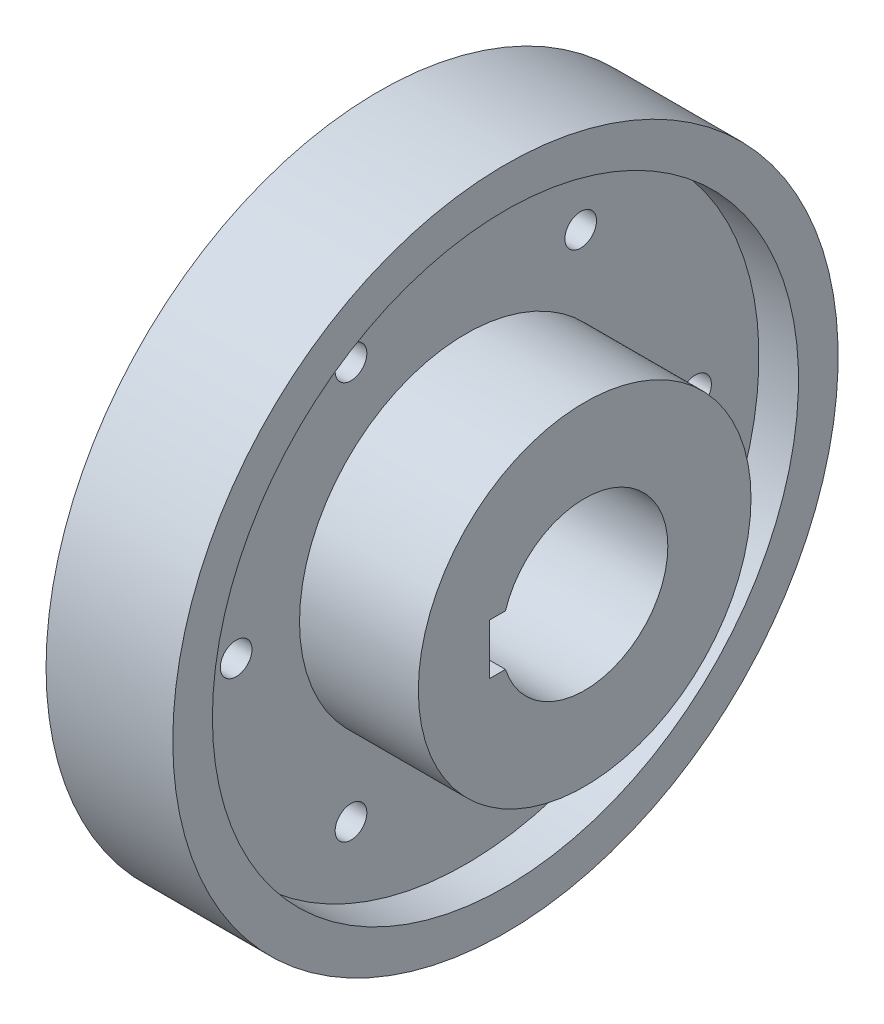
from build123d import *

# Parameters (mm, degrees)
SKETCH3_R               = 10
CUT_EXTRUDE1_DEPTH      = 307.30866785
CIRPATTERN1_COUNT       = 6
CUT_EXTRUDE2_DEPTH      = 325.191301549
CUT_EXTRUDE2_DEPTH_BACK = 325.191301549
SKETCH4_W               = 32
SKETCH4_H               = 10
CUT_EXTRUDE3_DEPTH      = 325.191301549
CUT_EXTRUDE3_DEPTH_BACK = 10
SKETCH5_R               = 100


with BuildPart() as part:
    # Sketch2 → Revolve1 (revolve)
    with BuildSketch(Plane(origin=(0, 0, 0), x_dir=(-1, 0, 0), z_dir=(0, 1, 0))):
        Polygon((-138.434782609, 52.5), (-268.434782609, 52.5), (-268.434782609, 105), (-193.434782609, 105), (-193.434782609, 185), (-218.434782609, 185), (-218.434782609, 210), (-138.434782609, 210), align=None)
    revolve(axis=Axis((0, 0, 0), (1, 0, 0)))

    # Sketch3 → Cut-Extrude1 (cut, through all)
    with BuildSketch(Plane.YZ.offset(193.434782609)):
        with Locations(Location((0, 145, 0), (0, 0, 270))):
            Circle(SKETCH3_R)
    cut_extrude1 = extrude(amount=-CUT_EXTRUDE1_DEPTH, mode=Mode.SUBTRACT)

    # CirPattern1: Cut-Extrude1 ×6 about axis
    cirpattern1_axis = Axis((0, 0, 0), (1, 0, 0))
    for i in range(1, CIRPATTERN1_COUNT):
        add(cut_extrude1.rotate(cirpattern1_axis, i * 360 / CIRPATTERN1_COUNT), mode=Mode.SUBTRACT)

    # Sketch4 → Cut-Extrude2 (cut, two sides: drawn at the far end of the back side and taken through both)
    with BuildSketch(Plane(origin=(138.434782609, 0, 0), x_dir=(0, -1, 0), z_dir=(-1, 0, 0)).offset(-CUT_EXTRUDE2_DEPTH_BACK)):
        with Locations((0, 55.002499938)):
            Rectangle(SKETCH4_W, SKETCH4_H)
    extrude(amount=CUT_EXTRUDE2_DEPTH + CUT_EXTRUDE2_DEPTH_BACK, mode=Mode.SUBTRACT)

    # Sketch5 → Cut-Extrude3 (cut, two sides: drawn at the far end of the back side and taken through both)
    with BuildSketch(Plane(origin=(138.434782609, 0, 0), x_dir=(0, -1, 0), z_dir=(-1, 0, 0)).offset(-CUT_EXTRUDE3_DEPTH_BACK)):
        with Locations(Location((0, 0, 0), (0, 0, 270))):
            Circle(SKETCH5_R)
    extrude(amount=CUT_EXTRUDE3_DEPTH + CUT_EXTRUDE3_DEPTH_BACK, mode=Mode.SUBTRACT)


solid = part.part
